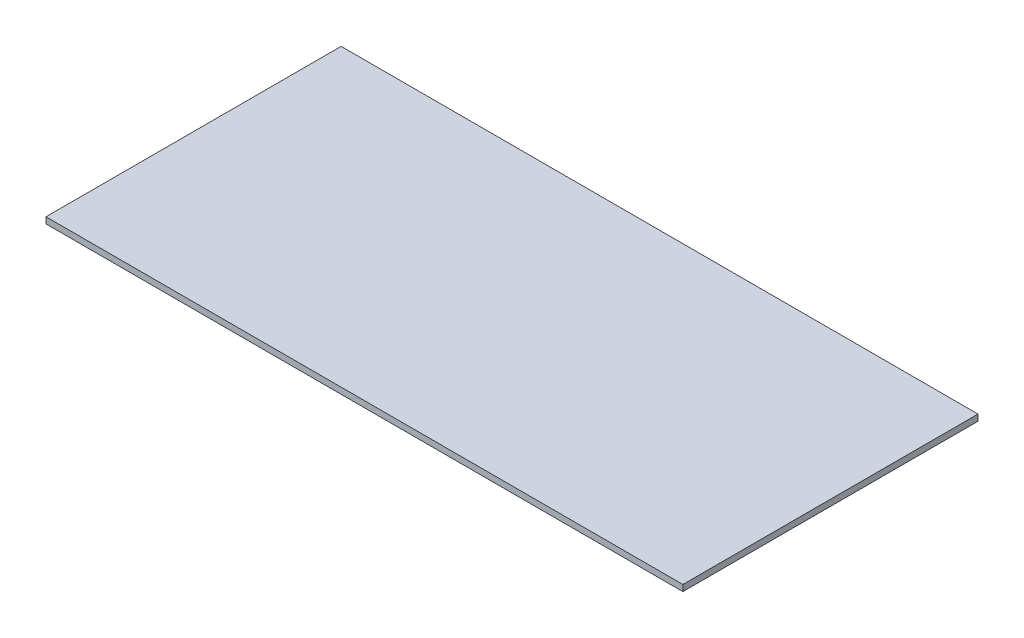
from build123d import *

# Parameters (mm, degrees)
SKETCH1_W           = 410
SKETCH1_H           = 190
BOSS_EXTRUDE1_DEPTH = 4


with BuildPart() as part:
    # Sketch1 → Boss-Extrude1 (new body)
    with BuildSketch(Plane(origin=(0, 0, 0), x_dir=(1, 0, 0), z_dir=(0, 1, 0))):
        Rectangle(SKETCH1_W, SKETCH1_H)
    extrude(amount=BOSS_EXTRUDE1_DEPTH)


solid = part.part
